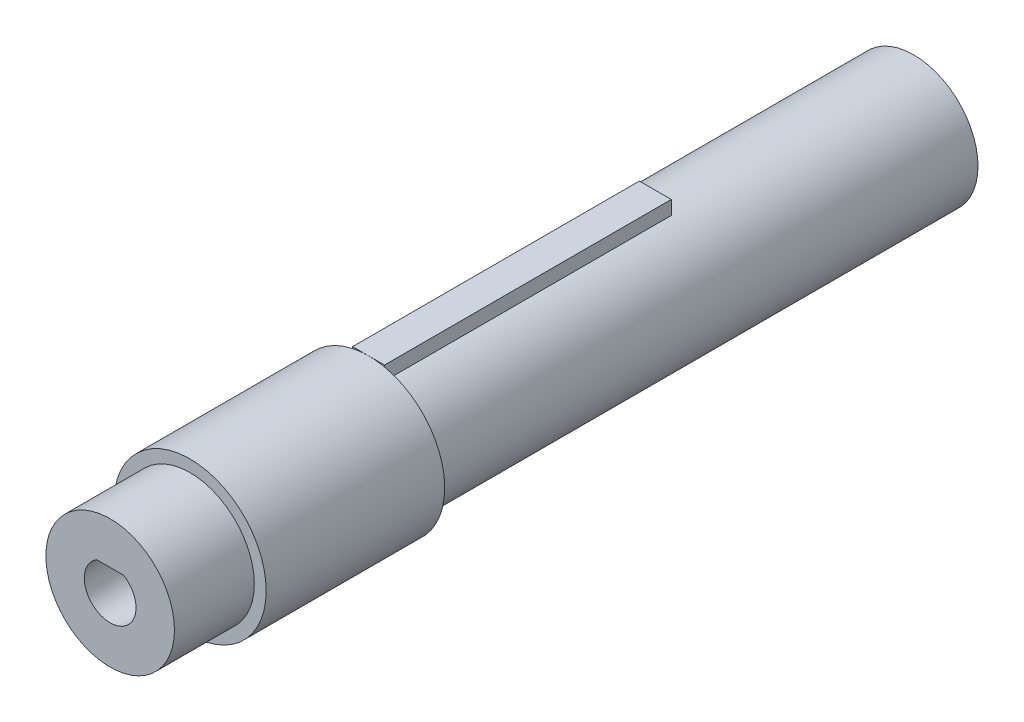
from build123d import *

# Parameters (mm, degrees)
SKETCH1_R                = 6.4
BOSS_EXTRUDE1_DEPTH      = 80
BOSS_EXTRUDE2_DEPTH      = 14.275
BOSS_EXTRUDE2_DEPTH_BACK = 14.275
SKETCH9_W                = 3.175
SKETCH9_H                = 4
BOSS_EXTRUDE3_START      = -7.9502
SKETCH10_R               = 7.5819
SKETCH10_R_2             = 5
BOSS_EXTRUDE3_DEPTH      = 17.7748


with BuildPart() as part:
    # Sketch1 → Boss-Extrude1 (new body)
    with BuildSketch(Plane.XY):
        Circle(SKETCH1_R)
        with BuildLine():
            Line((-1.34632834, 2.195), (1.34632834, 2.195))
            ThreePointArc((1.34632834, 2.195), (0, -2.575), (-1.34632834, 2.195))
        make_face(mode=Mode.SUBTRACT)
    extrude(amount=BOSS_EXTRUDE1_DEPTH)

    # Sketch9 → Boss-Extrude2 (add, two sides: drawn at the far end of the back side and taken through both)
    with BuildSketch(Plane.XY.offset(40).offset(-BOSS_EXTRUDE2_DEPTH_BACK)):
        with Locations((0, 5.5819)):
            Rectangle(SKETCH9_W, SKETCH9_H)
    extrude(amount=BOSS_EXTRUDE2_DEPTH + BOSS_EXTRUDE2_DEPTH_BACK)

    # Sketch10 → Boss-Extrude3 (add)
    with BuildSketch(Plane.XY.offset(80).offset(BOSS_EXTRUDE3_START)):
        Circle(SKETCH10_R)
        Circle(SKETCH10_R_2, mode=Mode.SUBTRACT)
    extrude(amount=-BOSS_EXTRUDE3_DEPTH)


solid = part.part
